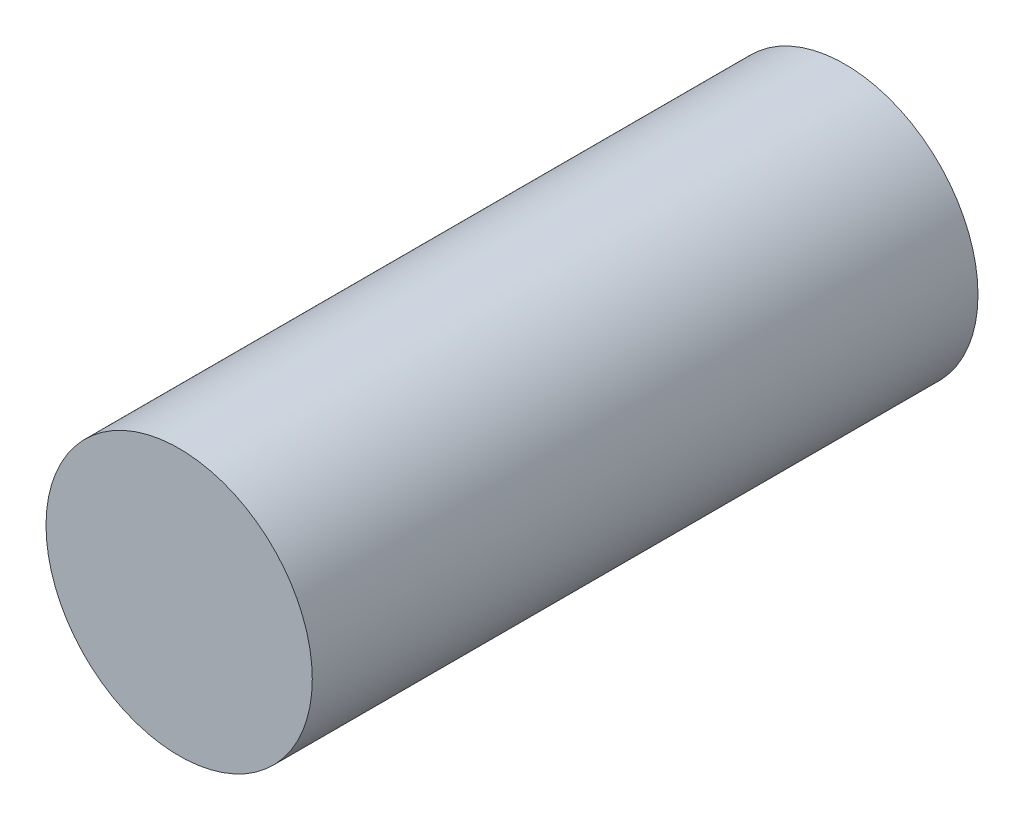
from build123d import *

# Parameters (mm, degrees)
SKETCH1_R           = 5
BOSS_EXTRUDE1_DEPTH = 12.5


with BuildPart() as part:
    # Sketch1 → Boss-Extrude1 (new, symmetric)
    with BuildSketch(Plane.XY):
        Circle(SKETCH1_R)
    extrude(amount=BOSS_EXTRUDE1_DEPTH, both=True)


solid = part.part
